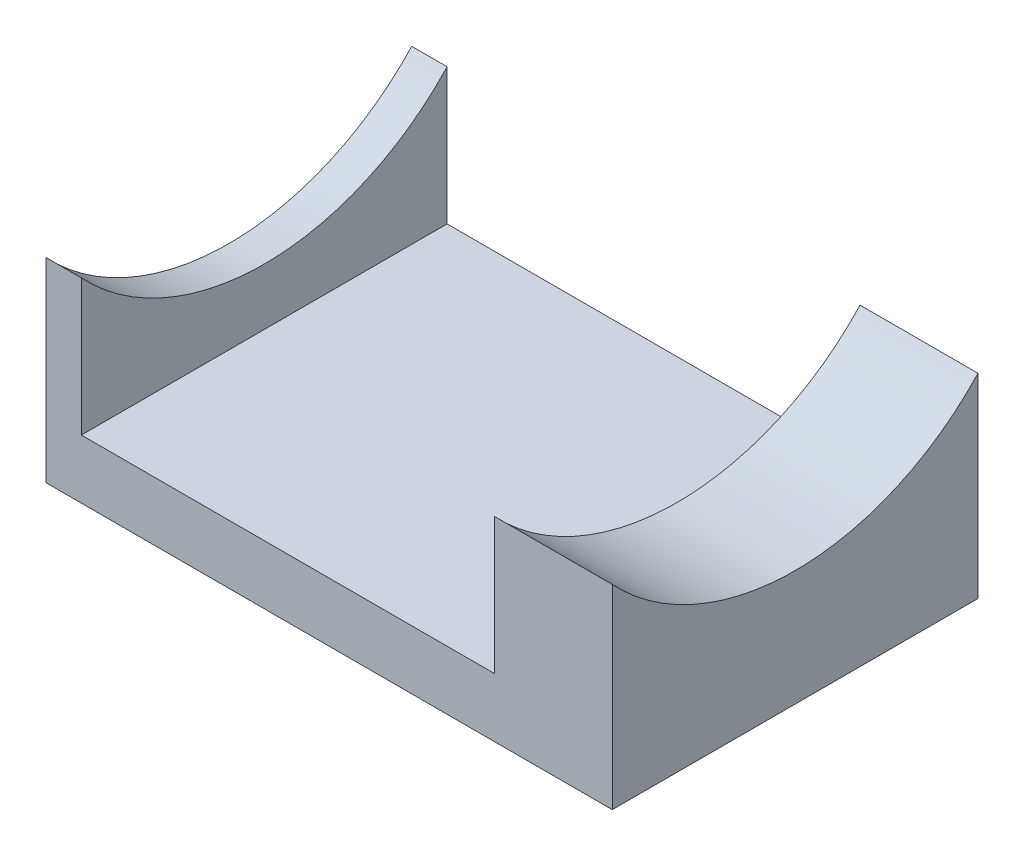
from build123d import *

# Parameters (mm, degrees)
SCHIZZO1_W                   = 48
SCHIZZO1_H                   = 31
ESTRUSIONE_ESTRUSIONE1_DEPTH = 15.5
TAGLIO_ESTRUSIONE1_REACH     = 44.157
SCHIZZO2_W                   = 35
SCHIZZO2_H                   = 26
SCHIZZO3_R                   = 21.2
TAGLIO_ESTRUSIONE2_DEPTH     = 53.768361733
SCHIZZO5_W                   = 2.5
SCHIZZO5_H                   = 5
RIPETIZIONE_A_L1_COUNT       = 2
RIPETIZIONE_A_L1_PITCH       = 20


with BuildPart() as part:
    # Schizzo1 → Estrusione-Estrusione1 (new, symmetric)
    with BuildSketch(Plane.XY):
        Rectangle(SCHIZZO1_W, SCHIZZO1_H)
    extrude(amount=ESTRUSIONE_ESTRUSIONE1_DEPTH, both=True)

    # Schizzo2 → Taglio-Estrusione1 (cut, up to next)
    with BuildSketch(Plane.XY.offset(15.5), mode=Mode.PRIVATE) as taglio_estrusione1_sk1:
        with Locations((-3.5, 2.5)):
            Rectangle(SCHIZZO2_W, SCHIZZO2_H)
    taglio_estrusione1_tool1 = extrude(taglio_estrusione1_sk1.sketch, amount=-TAGLIO_ESTRUSIONE1_REACH, mode=Mode.PRIVATE) & part.part
    add(taglio_estrusione1_tool1.solids().sort_by_distance((-3.5, 2.5, 15.5))[0], mode=Mode.SUBTRACT)

    # Schizzo3 → Taglio-Estrusione2 (cut, through all)
    with BuildSketch(Plane(origin=(24, 0, 0), x_dir=(0, 0, -1), z_dir=(1, 0, 0))):
        with Locations((0, 15.5)):
            Circle(SCHIZZO3_R)
    extrude(amount=-TAGLIO_ESTRUSIONE2_DEPTH, mode=Mode.SUBTRACT)

    # Schizzo5 → Rivoluzione2 (revolve)
    with BuildSketch(Plane.XY, mode=Mode.PRIVATE) as rivoluzione2_sk:
        with Locations((10.25, -18)):
            Rectangle(SCHIZZO5_W, SCHIZZO5_H)
    rivoluzione2 = revolve(rivoluzione2_sk.sketch.rotate(Axis((9, -15.5, 0), (0, -1, 0)), 90), axis=Axis((9, -15.5, 0), (0, -1, 0)))

    # Ripetizione a L1: Rivoluzione2 ×2
    with Locations(*[(-i * RIPETIZIONE_A_L1_PITCH, 0, 0) for i in range(1, RIPETIZIONE_A_L1_COUNT)]):
        add(rivoluzione2)


solid = part.part
